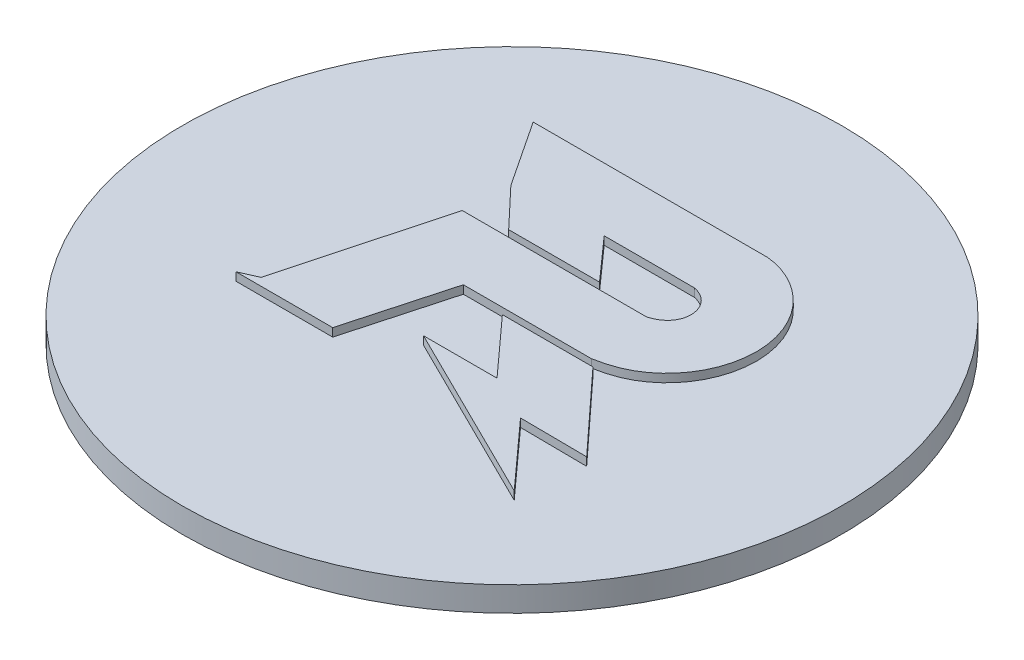
from build123d import *

# Parameters (mm, degrees)
SKETCH_6_R      = 40
EXTRUDE_1_DEPTH = 3
EXTRUDE_2_DEPTH = 1


with BuildPart() as part:
    # 草图6 → 凸台-拉伸1 (new body)
    with BuildSketch(Plane(origin=(0, 0, 0), x_dir=(1, 0, 0), z_dir=(0, 1, 0))):
        with Locations(Location((19.514251299, 24.77976127, 0), (0, 0, 270))):
            Circle(SKETCH_6_R)
    extrude(amount=-EXTRUDE_1_DEPTH)

    # 草图5 → 凸台-拉伸2 (add)
    with BuildSketch(Plane(origin=(0, 0, 0), x_dir=(1, 0, 0), z_dir=(0, 1, 0))):
        with BuildLine():
            Line((-0.848561441, 11.65053417), (10.884604209, 11.65053417))
            Line((10.884604209, 11.65053417), (14.304935387, 24.086135056))
            Line((14.304935387, 24.086135056), (29.829988347, 24.086135056))
            add(Edge.make_bspline(
                [(29.829988347, 24.086135056), (31.936484303, 24.4825638), (34.318672471, 25.163188991), (36.899310154, 26.291897866), (41.512516948, 30.702347463), (41.488102133, 36.127500115), (39.148657484, 41.930059677), (35.435285923, 42.747710664), (34.028305284, 45.040203592), (29.903175199, 45.422244415)],
                knots=[0, 0, 0, 0, 0, 0, 0, 0, 0, 0, 1, 1, 1, 1, 1, 1, 1, 1, 1, 1], degree=9))
            Line((29.903175199, 45.422244415), (1.440650879, 45.422244415))
            Line((1.440650879, 45.422244415), (6.750403312, 37.405182946))
            Line((6.750403312, 37.405182946), (11.26337671, 32.626274642))
            Line((11.26337671, 32.626274642), (22.289106818, 32.626274642))
            Line((22.289106818, 32.626274642), (17.706952403, 37.77757749))
            Line((17.706952403, 37.77757749), (28.656556673, 37.77757749))
            add(Edge.make_bspline(
                [(28.656556673, 37.77757749), (30.140944485, 37.467864792), (32.017287649, 36.447603196), (32.240103399, 33.011549778), (30.02639504, 32.225274016), (28.810885255, 31.820229302)],
                knots=[0, 0, 0, 0, 0, 0, 1, 1, 1, 1, 1, 1], degree=5))
            Line((28.810885255, 31.820229302), (6.42710467, 31.820229302))
            Line((6.42710467, 31.820229302), (1.262783116, 12.592072153))
            Line((1.262783116, 12.592072153), (-0.848561441, 11.65053417))
        make_face()
        Polygon((39.877064038, 13.479058766), (30.809384671, 23.309535699), (19.814492322, 23.309535699), (26.172284787, 16.30574677), (17.246103581, 16.30574677), (38.422169227, 5.825267085), (39.049534436, 5.514770865), (31.775865335, 13.552375437), align=None)
    extrude(amount=EXTRUDE_2_DEPTH)


solid = part.part
